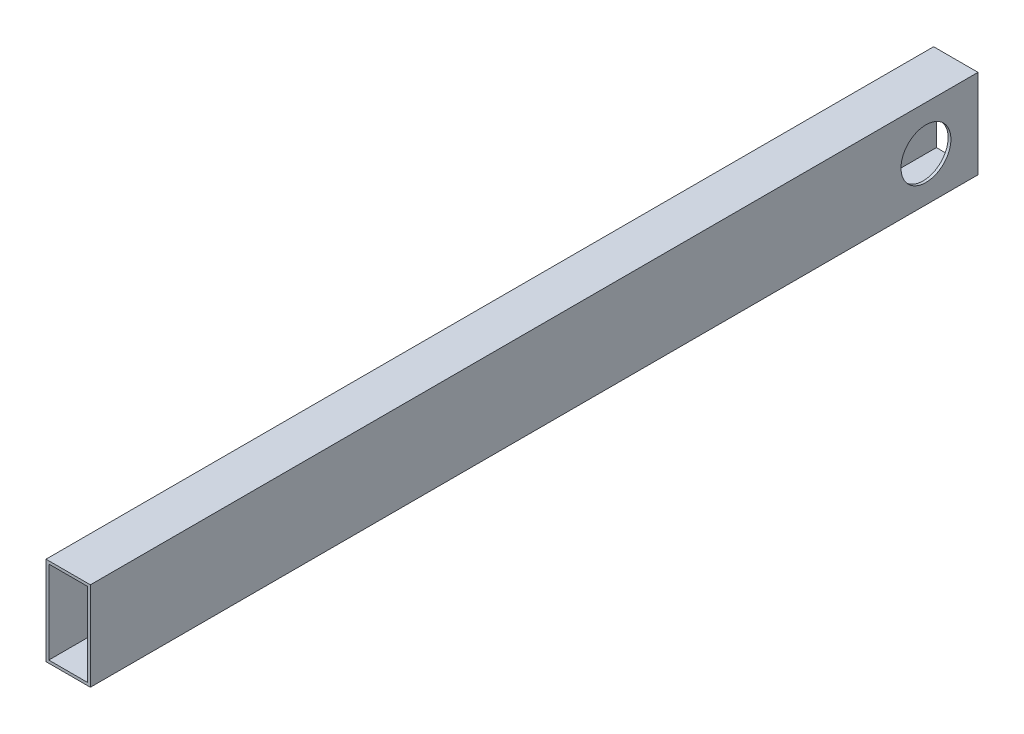
from build123d import *

# Parameters (mm, degrees)
SKETCH1_W           = 25.4
SKETCH1_H           = 50.8
SKETCH1_W_2         = 22.225
SKETCH1_H_2         = 47.625
BOSS_EXTRUDE1_DEPTH = 254
SKETCH2_R           = 14.2875
CUT_EXTRUDE1_DEPTH  = 257.527425434


with BuildPart() as part:
    # Sketch1 → Boss-Extrude1 (new, symmetric)
    with BuildSketch(Plane.XY):
        Rectangle(SKETCH1_W, SKETCH1_H)
        Rectangle(SKETCH1_W_2, SKETCH1_H_2, mode=Mode.SUBTRACT)
    extrude(amount=BOSS_EXTRUDE1_DEPTH, both=True)

    # Sketch2 → Cut-Extrude1 (cut, through all)
    with BuildSketch(Plane(origin=(12.7, 0, 0), x_dir=(0, 0, -1), z_dir=(1, 0, 0))):
        with Locations((224.210207487, 0)):
            Circle(SKETCH2_R)
    extrude(amount=-CUT_EXTRUDE1_DEPTH, mode=Mode.SUBTRACT)


solid = part.part
